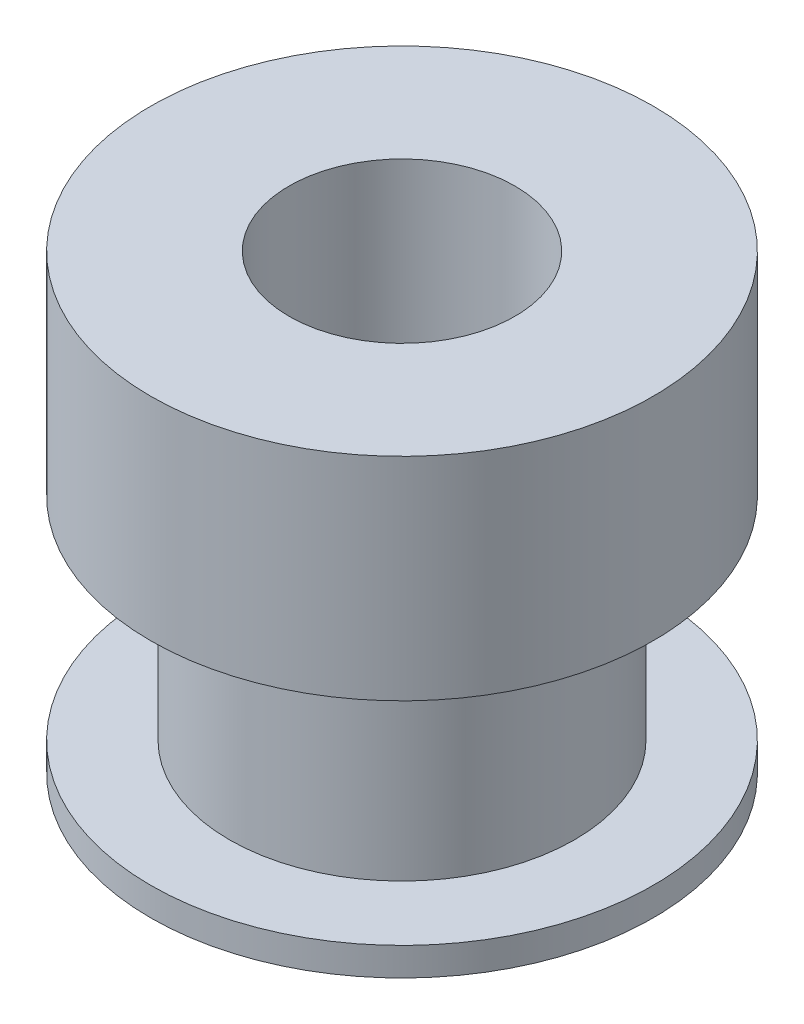
from build123d import *


with BuildPart() as part:
    # Esquisse1 → Révolution1 (revolve)
    with BuildSketch(Plane.XY, mode=Mode.PRIVATE) as r_volution1_sk:
        Polygon((4, 0), (8.9, 0), (8.9, 1), (6.11, 1), (6.11, 8.5), (8.9, 8.5), (8.9, 16), (4, 16), align=None)
    revolve(r_volution1_sk.sketch.rotate(Axis((0, 0, 0), (0, 1, 0)), 90), axis=Axis((0, 0, 0), (0, 1, 0)))


solid = part.part
